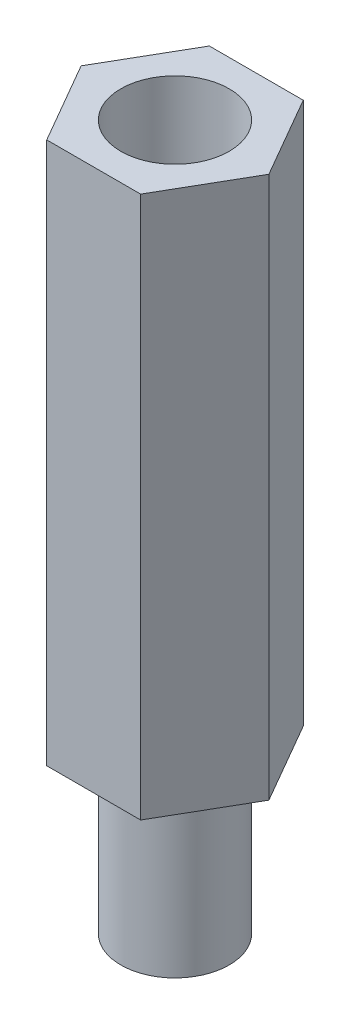
from build123d import *

# Parameters (mm, degrees)
SKETCH_1_R           = 2
EXTRUDE_1_DEPTH      = 20
EXTRUDE_2_DEPTH      = 6
EXTRUDE_2_DEPTH_BACK = 5
SKETCH_2_R           = 2


with BuildPart() as part:
    # 草图1 → 凸台-拉伸1 (new body)
    with BuildSketch(Plane(origin=(0, 0, 0), x_dir=(1, 0, 0), z_dir=(0, 1, 0))):
        Polygon((3.464101615, 0), (1.732050808, 3), (-1.732050808, 3), (-3.464101615, 0), (-1.732050808, -3), (1.732050808, -3), align=None)
        with Locations(Location((0, 0, 0), (0, 0, 270))):
            Circle(SKETCH_1_R, mode=Mode.SUBTRACT)
    extrude(amount=EXTRUDE_1_DEPTH)

    # 草图2 → 凸台-拉伸2 (add, two sides: drawn at the far end of the back side and taken through both)
    with BuildSketch(Plane.XZ.offset(-EXTRUDE_2_DEPTH_BACK)):
        with Locations(Location((0, 0, 0), (0, 0, 270))):
            Circle(SKETCH_2_R)
    extrude(amount=EXTRUDE_2_DEPTH + EXTRUDE_2_DEPTH_BACK)


solid = part.part
